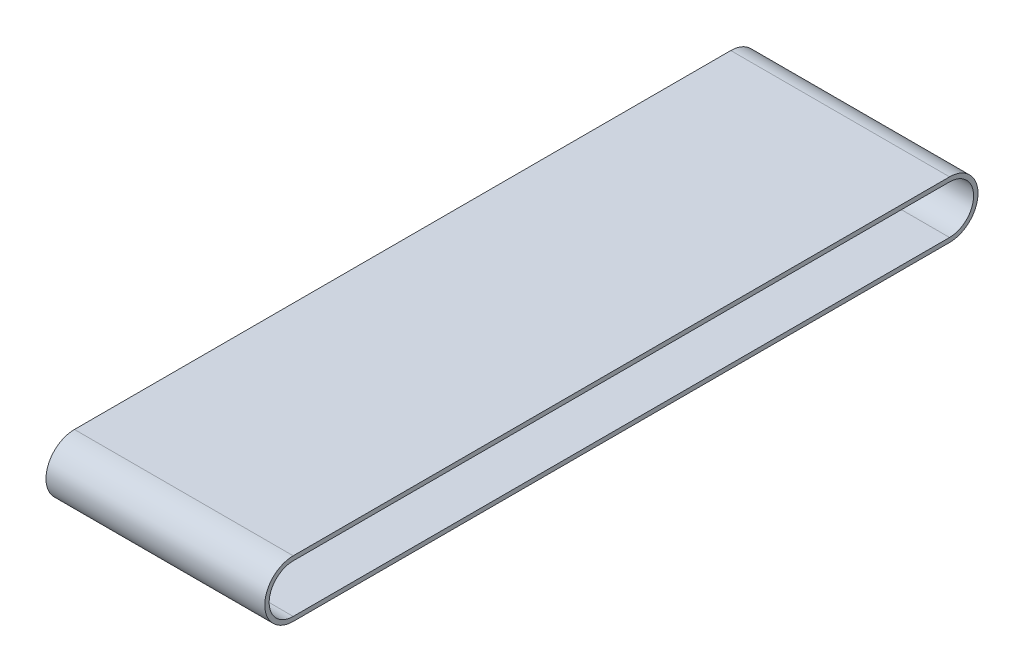
from build123d import *

# Parameters (mm, degrees)
BOSS_EXTRUDE1_DEPTH = 100


with BuildPart() as part:
    # Sketch1 → Boss-Extrude1 (new body)
    with BuildSketch(Plane(origin=(0, 0, 0), x_dir=(0, 0, -1), z_dir=(1, 0, 0))):
        with BuildLine():
            Line((-183.678713125, 35.848101266), (116.321286875, 35.848101266))
            ThreePointArc((116.321286875, 35.848101266), (129.321286875, 22.848101266), (116.321286875, 9.848101266))
            Line((116.321286875, 9.848101266), (-183.678713125, 9.848101266))
            ThreePointArc((-183.678713125, 9.848101266), (-196.678713125, 22.848101266), (-183.678713125, 35.848101266))
        make_face()
        with BuildLine():
            Line((-183.678713125, 11.848101266), (116.321286875, 11.848101266))
            ThreePointArc((116.321286875, 11.848101266), (127.321286875, 22.848101266), (116.321286875, 33.848101266))
            Line((116.321286875, 33.848101266), (-183.678713125, 33.848101266))
            ThreePointArc((-183.678713125, 33.848101266), (-194.678713125, 22.848101266), (-183.678713125, 11.848101266))
        make_face(mode=Mode.SUBTRACT)
    extrude(amount=BOSS_EXTRUDE1_DEPTH)


solid = part.part
